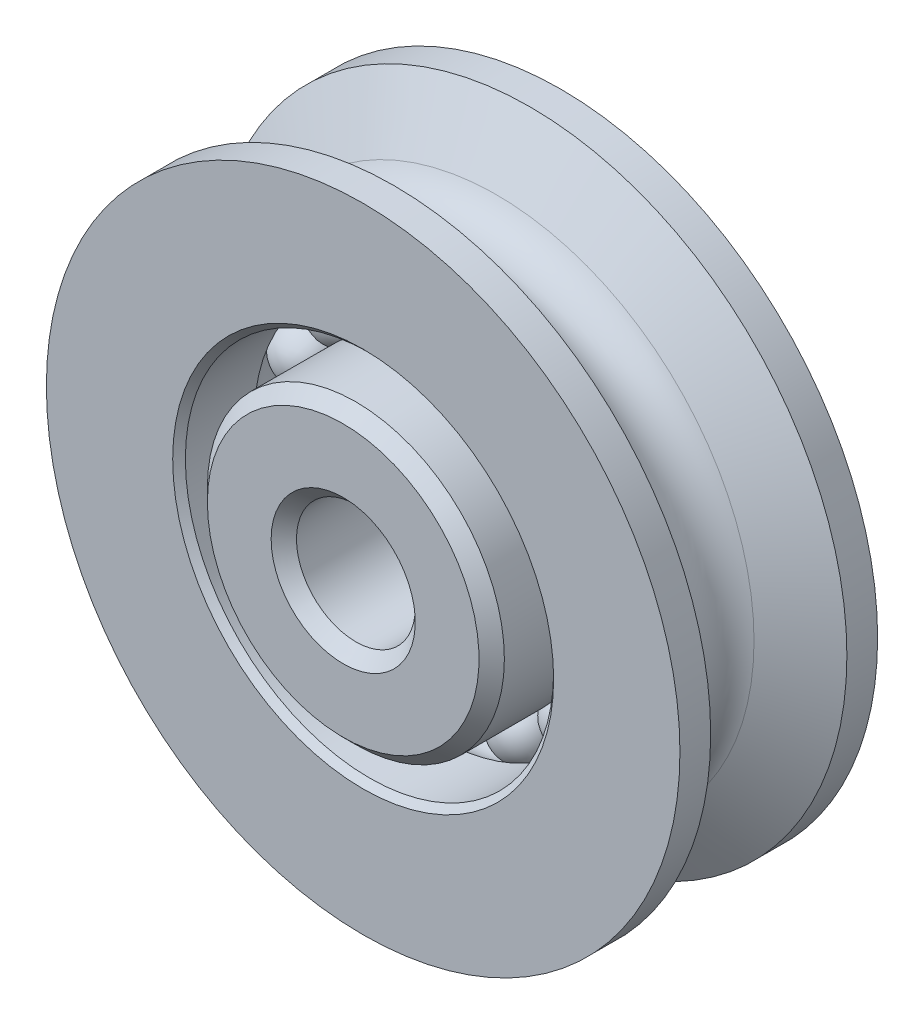
from build123d import *

# Parameters (mm, degrees)
CIRPATTERN1_COUNT = 16
CHAMFER1_SIZE     = 0.508
CHAMFER2_SIZE     = 0.254


with BuildPart() as part:
    # Sketch1 → Revolve1 (revolve)
    with BuildSketch(Plane(origin=(0, 0, 0), x_dir=(0, 0, -1), z_dir=(1, 0, 0)), mode=Mode.PRIVATE) as revolve1_sk:
        with BuildLine():
            Line((2.7305, 12.7), (3.9624, 12.7))
            Line((3.9624, 12.7), (3.9624, 7.381875))
            Line((3.9624, 7.381875), (0.9525, 7.381875))
            ThreePointArc((0.9525, 7.381875), (0, 7.858125), (-0.9525, 7.381875))
            Line((-0.9525, 7.381875), (-3.9624, 7.381875))
            Line((-3.9624, 7.381875), (-3.9624, 12.7))
            Line((-3.9624, 12.7), (-2.7305, 12.7))
            Line((-2.7305, 12.7), (-1.379597817, 10.327091754))
            ThreePointArc((-1.379597817, 10.327091754), (0, 9.525), (1.379597817, 10.327091754))
            Line((1.379597817, 10.327091754), (2.7305, 12.7))
        make_face()
        with BuildLine():
            Line((4.7625, 2.38125), (-4.7625, 2.38125))
            Line((-4.7625, 2.38125), (-4.7625, 5.953125))
            Line((-4.7625, 5.953125), (-0.9525, 5.953125))
            ThreePointArc((-0.9525, 5.953125), (0, 5.476875), (0.9525, 5.953125))
            Line((0.9525, 5.953125), (4.7625, 5.953125))
            Line((4.7625, 5.953125), (4.7625, 2.38125))
        make_face()
    revolve(revolve1_sk.sketch.rotate(Axis((0, 0, 4.7625), (0, 0, -1)), 90), axis=Axis((0, 0, 4.7625), (0, 0, -1)))

    # Chamfer1
    chamfer1_edges = [part.edges().sort_by_distance(p)[0] for p in [
        (-5.953125, 0, 4.7625),
        (-5.953125, 0, -4.7625),
        (-2.38125, 0, -4.7625),
        (-2.38125, 0, 4.7625),
    ]]
    chamfer(chamfer1_edges, length=CHAMFER1_SIZE)

    # Chamfer2
    chamfer2_edges = [part.edges().sort_by_distance(p)[0] for p in [
        (-7.381875, 0, -3.9624),
        (-7.381875, 0, 3.9624),
    ]]
    chamfer(chamfer2_edges, length=CHAMFER2_SIZE)


with BuildPart() as body_2:
    # Sketch2 → Revolve2 (revolve)
    with BuildSketch(Plane(origin=(0, 0, 0), x_dir=(0, 0, -1), z_dir=(1, 0, 0))):
        with BuildLine():
            Line((0, 7.858125), (0, 5.476875))
            ThreePointArc((0, 5.476875), (1.190625, 6.6675), (0, 7.858125))
        make_face()
    revolve(axis=Axis((0, 7.858125, 0), (0, -1, 0)))


with BuildPart() as cirpattern1_1:
    # CirPattern1: pattern copy
    add(body_2.part.rotate(Axis((0, 0, 0), (0, 0, 1)), 1 * 360 / CIRPATTERN1_COUNT))


with BuildPart() as cirpattern1_2:
    # CirPattern1: pattern copy
    add(body_2.part.rotate(Axis((0, 0, 0), (0, 0, 1)), 2 * 360 / CIRPATTERN1_COUNT))


with BuildPart() as cirpattern1_3:
    # CirPattern1: pattern copy
    add(body_2.part.rotate(Axis((0, 0, 0), (0, 0, 1)), 3 * 360 / CIRPATTERN1_COUNT))


with BuildPart() as cirpattern1_4:
    # CirPattern1: pattern copy
    add(body_2.part.rotate(Axis((0, 0, 0), (0, 0, 1)), 4 * 360 / CIRPATTERN1_COUNT))


with BuildPart() as cirpattern1_5:
    # CirPattern1: pattern copy
    add(body_2.part.rotate(Axis((0, 0, 0), (0, 0, 1)), 5 * 360 / CIRPATTERN1_COUNT))


with BuildPart() as cirpattern1_6:
    # CirPattern1: pattern copy
    add(body_2.part.rotate(Axis((0, 0, 0), (0, 0, 1)), 6 * 360 / CIRPATTERN1_COUNT))


with BuildPart() as cirpattern1_7:
    # CirPattern1: pattern copy
    add(body_2.part.rotate(Axis((0, 0, 0), (0, 0, 1)), 7 * 360 / CIRPATTERN1_COUNT))


with BuildPart() as cirpattern1_8:
    # CirPattern1: pattern copy
    add(body_2.part.rotate(Axis((0, 0, 0), (0, 0, 1)), 8 * 360 / CIRPATTERN1_COUNT))


with BuildPart() as cirpattern1_9:
    # CirPattern1: pattern copy
    add(body_2.part.rotate(Axis((0, 0, 0), (0, 0, 1)), 9 * 360 / CIRPATTERN1_COUNT))


with BuildPart() as cirpattern1_10:
    # CirPattern1: pattern copy
    add(body_2.part.rotate(Axis((0, 0, 0), (0, 0, 1)), 10 * 360 / CIRPATTERN1_COUNT))


with BuildPart() as cirpattern1_11:
    # CirPattern1: pattern copy
    add(body_2.part.rotate(Axis((0, 0, 0), (0, 0, 1)), 11 * 360 / CIRPATTERN1_COUNT))


with BuildPart() as cirpattern1_12:
    # CirPattern1: pattern copy
    add(body_2.part.rotate(Axis((0, 0, 0), (0, 0, 1)), 12 * 360 / CIRPATTERN1_COUNT))


with BuildPart() as cirpattern1_13:
    # CirPattern1: pattern copy
    add(body_2.part.rotate(Axis((0, 0, 0), (0, 0, 1)), 13 * 360 / CIRPATTERN1_COUNT))


with BuildPart() as cirpattern1_14:
    # CirPattern1: pattern copy
    add(body_2.part.rotate(Axis((0, 0, 0), (0, 0, 1)), 14 * 360 / CIRPATTERN1_COUNT))


with BuildPart() as cirpattern1_15:
    # CirPattern1: pattern copy
    add(body_2.part.rotate(Axis((0, 0, 0), (0, 0, 1)), 15 * 360 / CIRPATTERN1_COUNT))


solid = Compound([part.part, body_2.part, cirpattern1_1.part, cirpattern1_2.part, cirpattern1_3.part, cirpattern1_4.part, cirpattern1_5.part, cirpattern1_6.part, cirpattern1_7.part, cirpattern1_8.part, cirpattern1_9.part, cirpattern1_10.part, cirpattern1_11.part, cirpattern1_12.part, cirpattern1_13.part, cirpattern1_14.part, cirpattern1_15.part])
